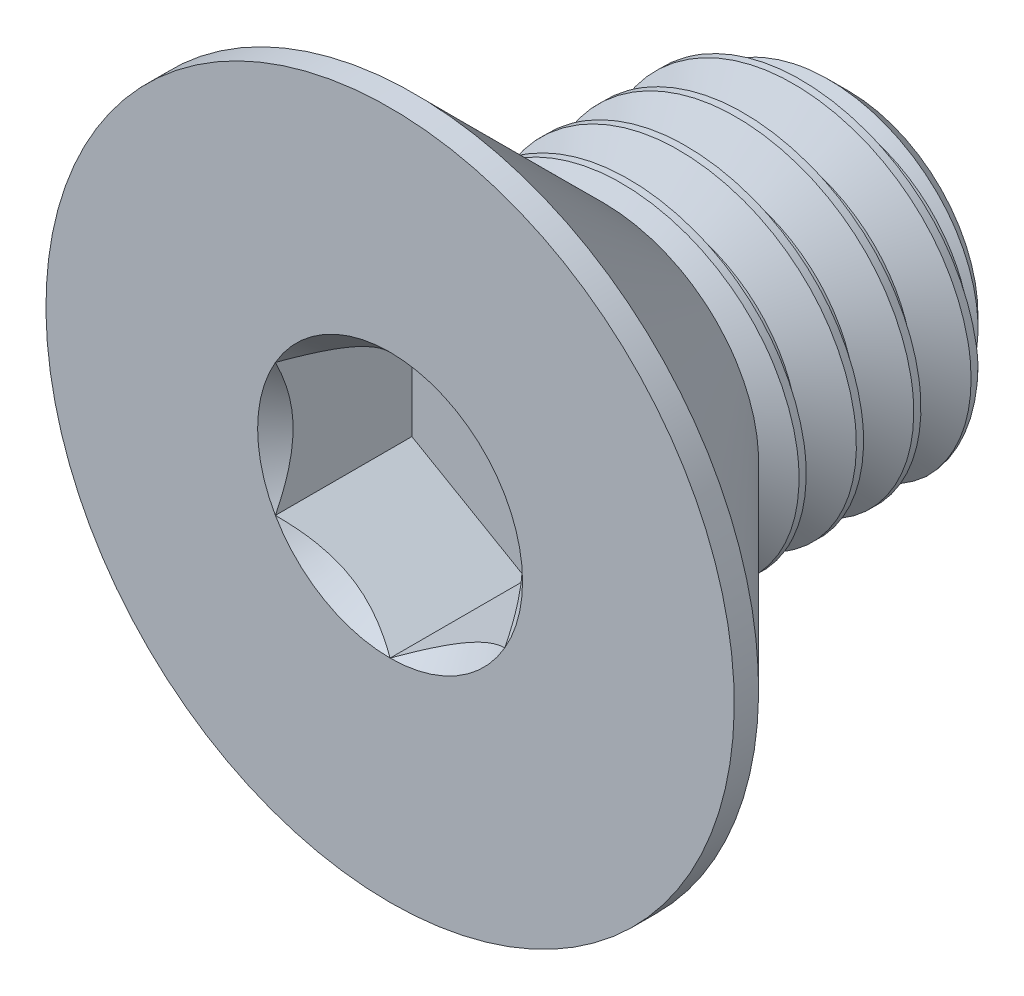
from build123d import *

# Parameters (mm, degrees)
SKETCH1_W              = 4
SKETCH1_H              = 1.5
CHAMFER1_SIZE          = 0.375
SKETCH8_R              = 1.5125
BOSS_EXTRUDE1_DEPTH    = 2.3
BOSS_EXTRUDE1_DRAFT    = -45
CUT_EXTRUDE2_DEPTH     = 1.19
CUT_SWEEP1_PITCH       = 0.5
CUT_SWEEP1_HEIGHT      = 2.8
CUT_SWEEP1_RADIUS      = 1.5
CUT_SWEEP1_START_ANGLE = 90


with BuildPart() as part:
    # Sketch1 → Revolve1 (revolve)
    with BuildSketch(Plane(origin=(0, 0, 0), x_dir=(0, 0, -1), z_dir=(1, 0, 0))):
        with Locations((2, 0.75)):
            Rectangle(SKETCH1_W, SKETCH1_H)
    revolve(axis=Axis((0, 0, -4), (0, 0, 1)))

    # Chamfer1
    chamfer1_edges = [part.edges().sort_by_distance(p)[0] for p in [
        (0, -1.5, -4),
    ]]
    chamfer(chamfer1_edges, length=CHAMFER1_SIZE)

    # Sketch7 → Revolve2 (revolve)
    with BuildSketch(Plane(origin=(0, 0, 0), x_dir=(0, 0, -1), z_dir=(1, 0, 0)), mode=Mode.PRIVATE) as revolve2_sk:
        Polygon((0, 3), (0.2125, 3), (1.7, 1.5125), (1.7, 0), (0, 0), align=None)
    revolve(revolve2_sk.sketch.rotate(Axis((0, 0, 0), (0, 0, -1)), 180), axis=Axis((0, 0, 0), (0, 0, -1)))


with BuildPart() as boss_extrude1_tool:
    # Sketch8 → Boss-Extrude1 (with draft: the straight prism first)
    with BuildSketch(Plane.XY.offset(-1.7)):
        Circle(SKETCH8_R)
    extrude(amount=-BOSS_EXTRUDE1_DEPTH)
    # Boss-Extrude1: the draft: its side faces are tilted about the plane it starts from
    boss_extrude1_sides = [boss_extrude1_tool.faces().sort_by_distance(p)[0] for p in [
        (-1.5125, 0, -2.85),
    ]]
    draft(boss_extrude1_sides, Plane.XY.offset(-1.7), BOSS_EXTRUDE1_DRAFT)


with BuildPart() as part_1:
    add(part.part)

    # Boss-Extrude1: add boss_extrude1_tool
    add(boss_extrude1_tool.part)

    # Sketch5 → Cut-Extrude2 (cut)
    with BuildSketch(Plane.XY):
        Polygon((1, -0.577350269), (1, 0.577350269), (0, 1.154700538), (-1, 0.577350269), (-1, -0.577350269), (0, -1.154700538), align=None)
    extrude(amount=-CUT_EXTRUDE2_DEPTH, mode=Mode.SUBTRACT)

    # Cut-Extrude3 cone 1 section (through the dimple's axis) → Cut-Extrude3 (revolve, cut)
    with BuildSketch(Plane(origin=(0, 0, 0), x_dir=(0, -1, 0), z_dir=(1, 0, 0))):
        Polygon((0, 0), (1.154700538, 0), (0, 1.154700538), align=None)
    revolve(axis=Axis((0, 0, 0), (0, 0, -1)), mode=Mode.SUBTRACT)


with BuildPart() as body_2:
    # Split1: the piece on the far side of the plane
    add(part_1.part)
    split(bisect_by=Plane.XY.offset(-1.7125), keep=Keep.BOTTOM)

    # Cut-Sweep1: sweep along a helix
    with BuildLine() as cut_sweep1_path:
        add(Helix(CUT_SWEEP1_PITCH, CUT_SWEEP1_HEIGHT, CUT_SWEEP1_RADIUS, center=(0, 0, -4), direction=(0, 0, 1), mode=Mode.PRIVATE).rotate(Axis((0, 0, -4), (0, 0, 1)), CUT_SWEEP1_START_ANGLE))
    # Sketch2 → Cut-Sweep1 (sweep, cut)
    with BuildSketch(Plane(origin=(0, 0, 0), x_dir=(0, 0, -1), z_dir=(1, 0, 0))):
        Polygon((3.994226497, 1.51), (4.443273503, 1.51), (4.25, 1.175240474), (4.1875, 1.175240474), align=None)
    sweep(path=cut_sweep1_path.line, is_frenet=True, mode=Mode.SUBTRACT)

    # Sketch13 → Revolve3 (revolve)
    with BuildSketch(Plane(origin=(0, 0, 0), x_dir=(0, 0, -1), z_dir=(1, 0, 0)), mode=Mode.PRIVATE) as revolve3_sk:
        Polygon((2.057799462, 1.154700538), (2.057799462, 0), (1.286805556, 0), (1.286805556, 1.925694444), align=None)
    revolve(revolve3_sk.sketch.rotate(Axis((0, 0, -2.057799462), (0, 0, 1)), 170.663918296), axis=Axis((0, 0, -2.057799462), (0, 0, 1)))


with BuildPart() as part_2:
    add(part_1.part)

    # Split1
    split(bisect_by=Plane.XY.offset(-1.7125), keep=Keep.TOP)

    # Combine1: union body 2
    add(body_2.part)


solid = part_2.part
